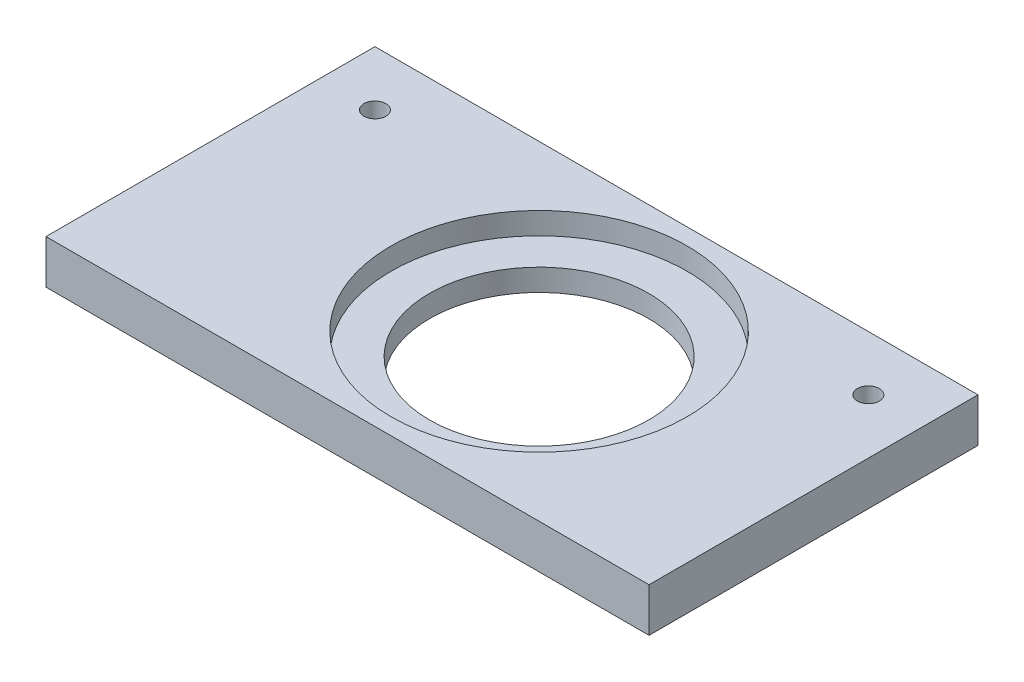
from build123d import *

# Parameters (mm, degrees)
SKETCH1_W                = 275
SKETCH1_H                = 150
SKETCH1_R                = 5
BOSS_EXTRUDE1_DEPTH      = 20
SKETCH2_R                = 50
CUT_EXTRUDE1_DEPTH       = 169.769131064
SKETCH3_R                = 67.5
CUT_EXTRUDE2_DEPTH       = 10
SKETCH4_R                = 5
CUT_EXTRUDE3_DEPTH       = 169.769131064
SKETCH5_W                = 19.05
SKETCH5_H                = 6.48
CUT_EXTRUDE4_DEPTH       = 0.64
M2_CLEARANCE_HOLE1_D     = 2.6
M2_CLEARANCE_HOLE1_DEPTH = 2
M2_CLEARANCE_HOLE1_TIP   = 0.781118805


with BuildPart() as part:
    # Sketch1 → Boss-Extrude1 (new body)
    with BuildSketch(Plane(origin=(0, 0, 0), x_dir=(1, 0, 0), z_dir=(0, 1, 0))):
        with Locations((-12.36, 0)):
            Rectangle(SKETCH1_W, SKETCH1_H)
        with Locations(Location((0, 0, 0), (0, 0, 270))):
            Circle(SKETCH1_R, mode=Mode.SUBTRACT)
    extrude(amount=BOSS_EXTRUDE1_DEPTH)

    # Sketch2 → Cut-Extrude1 (cut, through all)
    with BuildSketch(Plane(origin=(0, 20, 0), x_dir=(1, 0, 0), z_dir=(0, 1, 0))):
        with Locations(Location((0, 0, 0), (0, 0, 270))):
            Circle(SKETCH2_R)
    extrude(amount=-CUT_EXTRUDE1_DEPTH, mode=Mode.SUBTRACT)

    # Sketch3 → Cut-Extrude2 (cut)
    with BuildSketch(Plane(origin=(0, 20, 0), x_dir=(1, 0, 0), z_dir=(0, 1, 0))):
        with Locations(Location((0, 0, 0), (0, 0, 270))):
            Circle(SKETCH3_R)
    extrude(amount=-CUT_EXTRUDE2_DEPTH, mode=Mode.SUBTRACT)

    # Sketch4 → Cut-Extrude3 (cut, through all)
    with BuildSketch(Plane(origin=(0, 20, 0), x_dir=(1, 0, 0), z_dir=(0, 1, 0))):
        with Locations(Location((100.14, 50, 0), (0, 0, 270))):
            Circle(SKETCH4_R)
        with Locations(Location((-124.86, 50, 0), (0, 0, 90))):
            Circle(SKETCH4_R)
    extrude(amount=-CUT_EXTRUDE3_DEPTH, mode=Mode.SUBTRACT)

    # Sketch5 → Cut-Extrude4 (cut)
    with BuildSketch(Plane.XZ):
        with Locations((-90.335, -71.76)):
            Rectangle(SKETCH5_W, SKETCH5_H)
        with Locations((65.615, -71.76)):
            Rectangle(SKETCH5_W, SKETCH5_H)
    extrude(amount=-CUT_EXTRUDE4_DEPTH, mode=Mode.SUBTRACT)

    # M2 Clearance Hole1
    with Locations(Plane(origin=(0, 0.64, 0), x_dir=(-1, 0, 0), z_dir=(0, -1, 0))):
        with Locations((95.9, 71.76), (84.77, 71.76), (-71.18, 71.76), (-60.20961626, 71.76)):
            Hole(M2_CLEARANCE_HOLE1_D / 2, depth=M2_CLEARANCE_HOLE1_DEPTH)
            with Locations((0, 0, -(M2_CLEARANCE_HOLE1_DEPTH + M2_CLEARANCE_HOLE1_TIP / 2))):  # 118° drill point
                Cone(0, M2_CLEARANCE_HOLE1_D / 2, M2_CLEARANCE_HOLE1_TIP, mode=Mode.SUBTRACT)


solid = part.part
